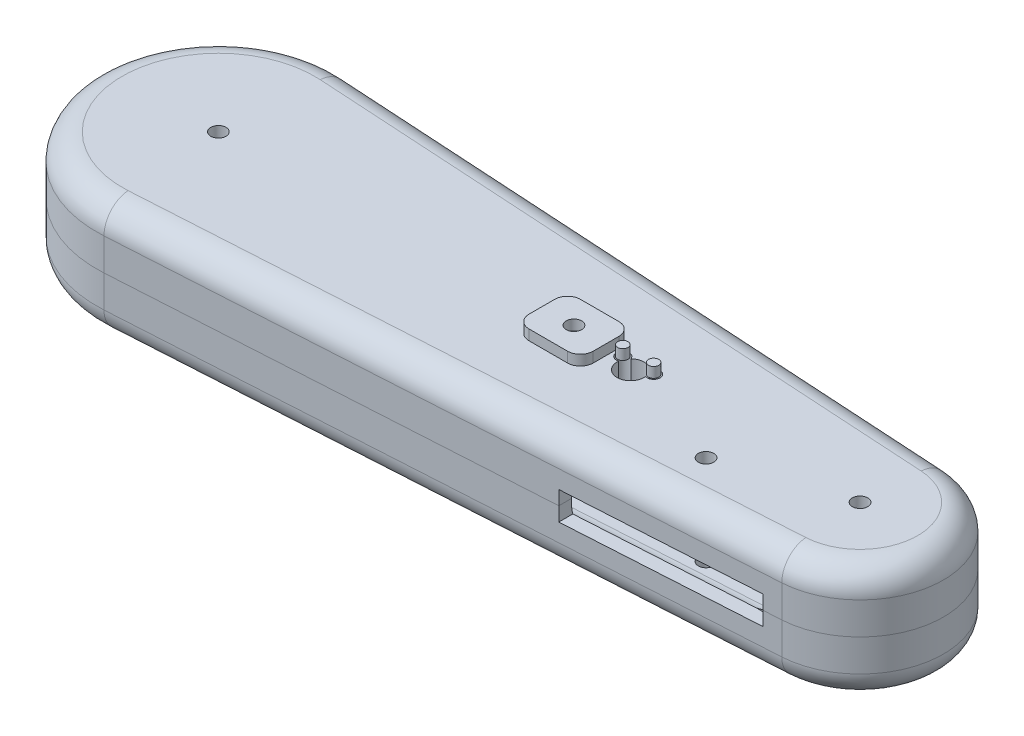
from build123d import *

# Parameters (mm, degrees)
CROQUIS1_R                 = 3
SALIENTE_EXTRUIR1_DEPTH    = 22.5
CORTAR_EXTRUIR1_DEPTH      = 12.5
CORTAR_EXTRUIR1_DEPTH_BACK = 12.5
CROQUIS2_R                 = 5
REDONDEO4_R                = 10
REDONDEO5_R                = 10
CROQUIS4_W                 = 75
CROQUIS4_H                 = 9.517146309
CORTAR_EXTRUIR2_DEPTH      = 5.5
CORTAR_EXTRUIR3_DEPTH      = 305.610407027
CORTAR_EXTRUIR3_DEPTH_BACK = 305.610407027
CROQUIS5_R                 = 3
CORTAR_EXTRUIR4_DEPTH      = 305.610407027
CORTAR_EXTRUIR4_DEPTH_BACK = 10
CROQUIS8_R                 = 2
SALIENTE_EXTRUIR2_DEPTH    = 4
SALIENTE_EXTRUIR2_2_DEPTH  = 4
CROQUIS8_R_2               = 3
SALIENTE_EXTRUIR2_3_DEPTH  = 4


with BuildPart() as part:
    # Croquis1 → Saliente-Extruir1 (new, symmetric)
    with BuildSketch(Plane(origin=(0, 0, 0), x_dir=(-1, 0, 0), z_dir=(0, 1, 0))):
        with BuildLine():
            Line((-1.95, 32.441447255), (247.15, 47.414422911))
            ThreePointArc((247.15, 47.414422911), (297.5, 0), (247.15, -47.414422911))
            Line((247.15, -47.414422911), (-1.95, -32.441447255))
            ThreePointArc((-1.95, -32.441447255), (-32.5, 0), (-1.95, 32.441447255))
        make_face()
        with Locations(Location((0, 0, 0), (0, 0, 270))):
            Circle(CROQUIS1_R, mode=Mode.SUBTRACT)
        with Locations(Location((250, 0, 0), (0, 0, 270))):
            Circle(CROQUIS1_R, mode=Mode.SUBTRACT)
        with Locations(Location((45, 15, 0), (0, 0, 270))):
            Circle(CROQUIS1_R, mode=Mode.SUBTRACT)
    extrude(amount=SALIENTE_EXTRUIR1_DEPTH, both=True)

    # Croquis2 → Cortar-Extruir1 (cut, two sides: drawn at the far end of the back side and taken through both)
    with BuildSketch(Plane(origin=(0, 0, 0), x_dir=(-1, 0, 0), z_dir=(0, 1, 0)).offset(-CORTAR_EXTRUIR1_DEPTH_BACK)):
        with BuildLine():
            Line((-1.65, -27.45045537), (247.45, -42.423431026))
            ThreePointArc((247.45, -42.423431026), (292.5, 0), (247.45, 42.423431026))
            Line((247.45, 42.423431026), (-1.65, 27.45045537))
            ThreePointArc((-1.65, 27.45045537), (-27.5, 0), (-1.65, -27.45045537))
        make_face()
        with Locations(Location((190, 0, 0), (0, 0, 90))):
            Circle(CROQUIS2_R, mode=Mode.SUBTRACT)
        with Locations(Location((25, 0, 0), (0, 0, 90))):
            Circle(CROQUIS2_R, mode=Mode.SUBTRACT)
    extrude(amount=CORTAR_EXTRUIR1_DEPTH + CORTAR_EXTRUIR1_DEPTH_BACK, mode=Mode.SUBTRACT)


with BuildPart() as body_2:
    # Partir1: the piece on the far side of the plane
    add(part.part)
    split(bisect_by=Plane.ZX, keep=Keep.BOTTOM)

    # Redondeo5
    redondeo5_edges = [body_2.edges().sort_by_distance(p)[0] for p in [
        (-292.5, -12.5, 0),
        (-122.9, -12.5, 34.936943198),
        (27.5, -12.5, 0),
        (-122.9, -12.5, -34.936943198),
        (32.5, -22.5, 0),
        (-122.6, -22.5, -39.927935083),
        (-297.5, -22.5, 0),
        (-122.6, -22.5, 39.927935083),
    ]]
    fillet(redondeo5_edges, radius=REDONDEO5_R)


with BuildPart() as part_1:
    add(part.part)

    # Partir1
    split(bisect_by=Plane.ZX, keep=Keep.TOP)

    # Redondeo4
    redondeo4_edges = [part_1.edges().sort_by_distance(p)[0] for p in [
        (-297.5, 22.5, 0),
        (-122.6, 22.5, 39.927935083),
        (-122.9, 12.5, 34.936943198),
        (27.5, 12.5, 0),
        (-122.9, 12.5, -34.936943198),
        (-292.5, 12.5, 0),
        (32.5, 22.5, 0),
        (-122.6, 22.5, -39.927935083),
    ]]
    fillet(redondeo4_edges, radius=REDONDEO4_R)


with BuildPart() as cortar_extruir2_tool:
    # Croquis4 → Cortar-Extruir2 (new, symmetric)
    with BuildSketch(Plane(origin=(0, 0, 0), x_dir=(-1, 0, 0), z_dir=(0, 1, 0))):
        with Locations((42.5, 32.60874867)):
            Rectangle(CROQUIS4_W, CROQUIS4_H)
    extrude(amount=CORTAR_EXTRUIR2_DEPTH, both=True)


with BuildPart() as part_2:
    add(part_1.part)

    # Cortar-Extruir2: cut by cortar_extruir2_tool
    add(cortar_extruir2_tool.part, mode=Mode.SUBTRACT)

    # Croquis6 → Cortar-Extruir4 (cut, two sides: drawn at the far end of the back side and taken through both)
    with BuildSketch(Plane(origin=(0, 22.5, 0), x_dir=(-1, 0, 0), z_dir=(0, 1, 0)).offset(-CORTAR_EXTRUIR4_DEPTH_BACK)):
        with BuildLine():
            ThreePointArc((85.79565282, -3.793525203), (89.424931885, -5.25), (93.05421095, -3.793525203))
            ThreePointArc((93.05421095, -3.793525203), (97.660999863, -4.118033989), (94.637319487, -0.62730813))
            ThreePointArc((94.637319487, -0.62730813), (89.424931885, 5.25), (84.212544284, -0.62730813))
            ThreePointArc((84.212544284, -0.62730813), (81.188863908, -4.118033989), (85.79565282, -3.793525203))
        make_face()
    extrude(amount=CORTAR_EXTRUIR4_DEPTH + CORTAR_EXTRUIR4_DEPTH_BACK, mode=Mode.SUBTRACT)


with BuildPart() as body_2_1:
    add(body_2.part)

    # Cortar-Extruir2: cut by cortar_extruir2_tool
    add(cortar_extruir2_tool.part, mode=Mode.SUBTRACT)

    # Croquis5 → Cortar-Extruir3 (cut, two sides: drawn at the far end of the back side and taken through both)
    with BuildSketch(Plane(origin=(0, 22.5, 0), x_dir=(-1, 0, 0), z_dir=(0, 1, 0)).offset(-CORTAR_EXTRUIR3_DEPTH_BACK)):
        with Locations(Location((111.457, 0, 0), (0, 0, 90))):
            Circle(CROQUIS5_R)
        with Locations(Location((176.457, 15, 0), (0, 0, 90))):
            Circle(CROQUIS5_R)
    extrude(amount=CORTAR_EXTRUIR3_DEPTH + CORTAR_EXTRUIR3_DEPTH_BACK, mode=Mode.SUBTRACT)


with BuildPart() as body_3:
    # Croquis8 → Saliente-Extruir2 (new body)
    with BuildSketch(Plane(origin=(0, 22.5, 0), x_dir=(-1, 0, 0), z_dir=(0, 1, 0))):
        with Locations(Location((83.424931885, -3, 0), (0, 0, 90))):
            Circle(CROQUIS8_R)
    extrude(amount=SALIENTE_EXTRUIR2_DEPTH)


with BuildPart() as body_4:
    # Croquis8 → Saliente-Extruir2 2 (new body)
    with BuildSketch(Plane(origin=(0, 22.5, 0), x_dir=(-1, 0, 0), z_dir=(0, 1, 0))):
        with Locations(Location((95.424931885, -3, 0), (0, 0, 90))):
            Circle(CROQUIS8_R)
    extrude(amount=SALIENTE_EXTRUIR2_2_DEPTH)


with BuildPart() as body_5:
    # Croquis8 → Saliente-Extruir2 3 (new body)
    with BuildSketch(Plane(origin=(0, 22.5, 0), x_dir=(-1, 0, 0), z_dir=(0, 1, 0))):
        with BuildLine():
            Line((103.957, -10), (118.957, -10))
            ThreePointArc((118.957, -10), (122.492533906, -8.535533906), (123.957, -5))
            Line((123.957, -5), (123.957, 5))
            ThreePointArc((123.957, 5), (122.492533906, 8.535533906), (118.957, 10))
            Line((118.957, 10), (103.957, 10))
            ThreePointArc((103.957, 10), (100.421466094, 8.535533906), (98.957, 5))
            Line((98.957, 5), (98.957, -5))
            ThreePointArc((98.957, -5), (100.421466094, -8.535533906), (103.957, -10))
        make_face()
        with Locations(Location((111.457, 0, 0), (0, 0, 90))):
            Circle(CROQUIS8_R_2, mode=Mode.SUBTRACT)
    extrude(amount=SALIENTE_EXTRUIR2_3_DEPTH)


solid = Compound([part_2.part, body_2_1.part, body_3.part, body_4.part, body_5.part])
